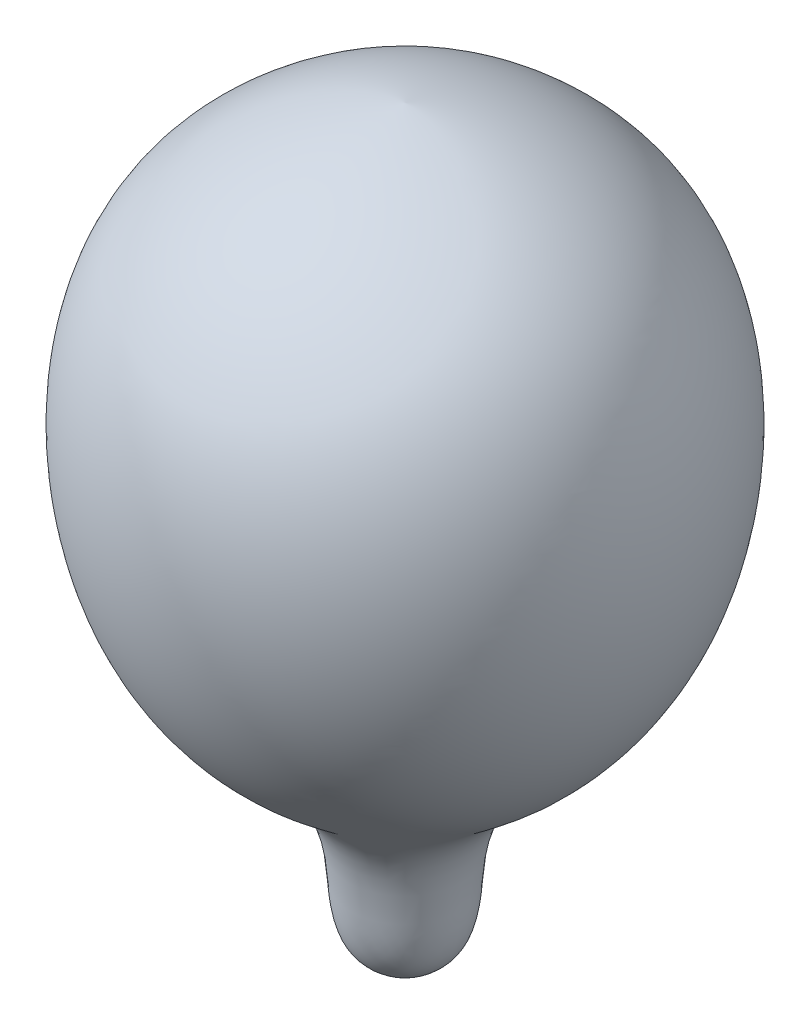
from build123d import *


with BuildPart() as part:
    # Sketch1 → Revolve4 (revolve)
    with BuildSketch(Plane.XY):
        with BuildLine():
            Line((0, 501.669276232), (0, 0))
            add(Edge.make_bspline(
                [(0, 501.669276232), (50.790256677, 496.039129861), (163.902843019, 443.638014571), (181.830829811, 267.518824208), (121.336519151, 151.522410807), (45.773430851, 107.722714017), (33.818977063, 46.60434838), (37.704751096, 6.945699286), (0, 0)],
                knots=[0, 0, 0, 0, 0.244027537, 0.505634389, 0.717447959, 0.831784086, 0.876368332, 1, 1, 1, 1], degree=3))
        make_face()
    revolve(axis=Axis((0, 726.941818068, 0), (0, -1, 0)))


solid = part.part
